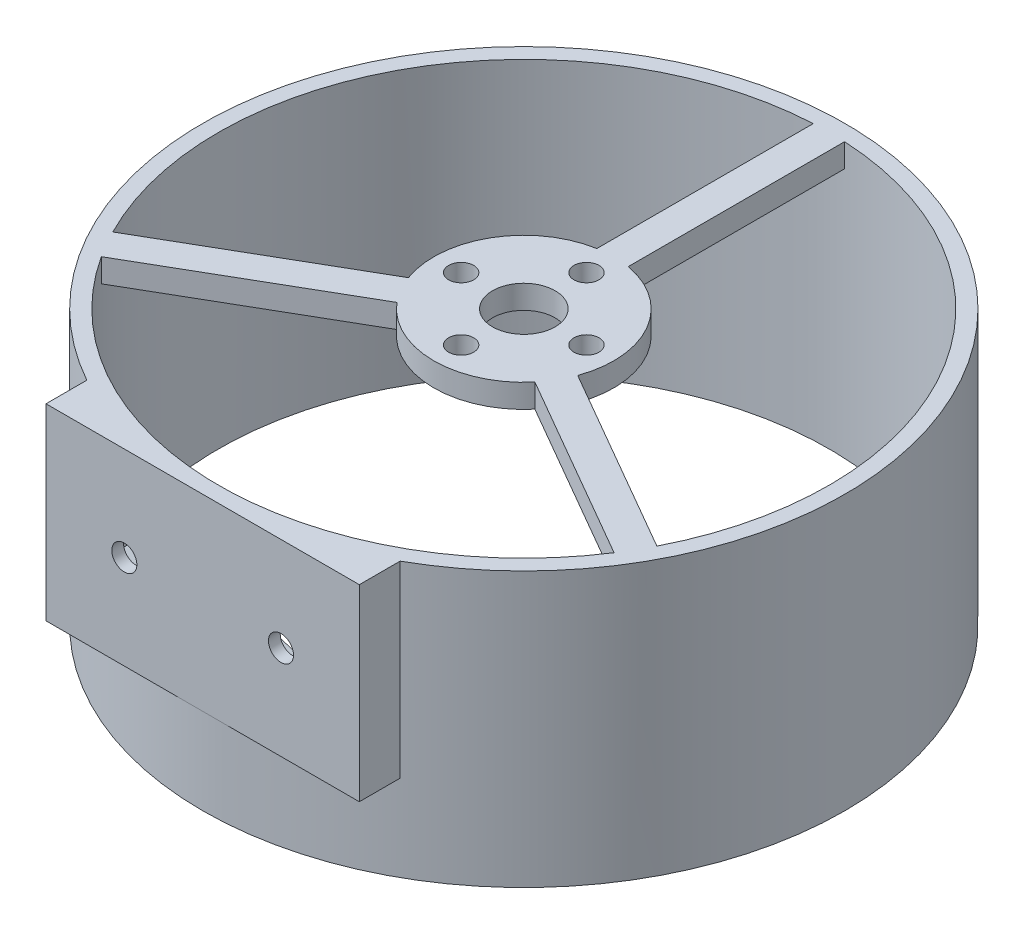
from build123d import *

# Parameters (mm, degrees)
SKETCH_1_R           = 41
SKETCH_1_R_2         = 39
EXTRUDE_1_DEPTH      = 20
EXTRUDE_START        = -14
EXTRUDE_2_DEPTH      = 14
EXTRUDE_START_2      = -3
SKETCH_3_R           = 4
SKETCH_3_R_2         = 1.6
EXTRUDE_3_DEPTH      = 3
CUT_EXTRUDE_3_DEPTH  = 3
EXTRUDE_5_DEPTH      = 10
EXTRUDE_5_DEPTH_BACK = 15
SKETCH_1_2_R         = 41
SKETCH_1_2_R_2       = 39
EXTRUDE_START_3      = 10
EXTRUDE_7_DEPTH      = 10
EXTRUDE_8_DEPTH      = 10
EXTRUDE_8_DEPTH_BACK = 5
CUT_EXTRUDE_4_DEPTH  = 10
EXTRUDE_9_DEPTH      = 10
EXTRUDE_9_DEPTH_BACK = 1.5
CUT_EXTRUDE_6_DEPTH  = 10
SKETCH_16_R          = 1.6
CUT_EXTRUDE_7_DEPTH  = 3
SKETCH_18_R          = 1.6
CUT_EXTRUDE_8_DEPTH  = 10
SKETCH_18_4_R        = 1.6
CUT_EXTRUDE_9_DEPTH  = 10


with BuildPart() as part:
    # 草图1 → 凸台-拉伸1 (new body)
    with BuildSketch(Plane(origin=(0, 0, 0), x_dir=(1, 0, 0), z_dir=(0, 1, 0))):
        Circle(SKETCH_1_R)
        Circle(SKETCH_1_R_2, mode=Mode.SUBTRACT)
    extrude(amount=EXTRUDE_1_DEPTH)

    # 草图2 → 凸台-拉伸2 (add)
    with BuildSketch(Plane(origin=(0, 20, 0), x_dir=(1, 0, 0), z_dir=(0, 1, 0)).offset(EXTRUDE_START)):
        with BuildLine():
            Line((3.5e-08, -41), (20, -41))
            Line((20, -41), (20, -35.791060336))
            ThreePointArc((20, -35.791060336), (10.333598766, -39.676400247), (3.5e-08, -41))
        make_face()
        with BuildLine():
            Line((-20, -41), (3.5e-08, -41))
            ThreePointArc((3.5e-08, -41), (-10.333598732, -39.676400256), (-20, -35.791060336))
            Line((-20, -35.791060336), (-20, -41))
        make_face()
    extrude(amount=EXTRUDE_2_DEPTH)

    # 草图3 → 凸台-拉伸3 (add)
    with BuildSketch(Plane(origin=(0, 20, 0), x_dir=(1, 0, 0), z_dir=(0, 1, 0)).offset(EXTRUDE_START_2)):
        with BuildLine():
            Line((-2, 38.948684188), (-2, 11.324751653))
            ThreePointArc((-2, 11.324751653), (-9.959292144, 5.75), (-10.807522623, -3.930325019))
            Line((-10.807522623, -3.930325019), (-34.730549951, -17.742291287))
            ThreePointArc((-34.730549951, -17.742291287), (-33.774990748, -19.5), (-32.730549951, -21.206392902))
            Line((-32.730549951, -21.206392902), (-8.807522623, -7.394426634))
            ThreePointArc((-8.807522623, -7.394426634), (0, -11.5), (8.807522623, -7.394426634))
            Line((8.807522623, -7.394426634), (32.730549951, -21.206392902))
            ThreePointArc((32.730549951, -21.206392902), (33.774990748, -19.5), (34.730549951, -17.742291287))
            Line((34.730549951, -17.742291287), (10.807522623, -3.930325019))
            ThreePointArc((10.807522623, -3.930325019), (9.959292144, 5.75), (2, 11.324751653))
            Line((2, 11.324751653), (2, 38.948684188))
            ThreePointArc((2, 38.948684188), (0, 39), (-2, 38.948684188))
        make_face()
        Circle(SKETCH_3_R, mode=Mode.SUBTRACT)
        with Locations((-8, 0)):
            Circle(SKETCH_3_R_2, mode=Mode.SUBTRACT)
        with Locations((8, 0)):
            Circle(SKETCH_3_R_2, mode=Mode.SUBTRACT)
    extrude(amount=EXTRUDE_3_DEPTH)

    # 草图7 → 切除-拉伸3 (cut)
    with BuildSketch(Plane.XZ.offset(-6)):
        with BuildLine():
            Line((0, 41), (-20, 41))
            Line((-20, 41), (-20, 35.791060336))
            ThreePointArc((-20, 35.791060336), (-10.333598749, 39.676400251), (0, 41))
        make_face()
        with BuildLine():
            Line((20, 41), (0, 41))
            ThreePointArc((0, 41), (10.333598749, 39.676400251), (20, 35.791060336))
            Line((20, 35.791060336), (20, 41))
        make_face()
    extrude(amount=-CUT_EXTRUDE_3_DEPTH, mode=Mode.SUBTRACT)

    # 草图1<2> → 凸台-拉伸5 (add, two sides: drawn at the far end of the back side and taken through both)
    with BuildSketch(Plane(origin=(0, 0, 0), x_dir=(1, 0, 0), z_dir=(0, 1, 0)).offset(-EXTRUDE_5_DEPTH_BACK)):
        Circle(SKETCH_1_2_R)
        Circle(SKETCH_1_2_R_2, mode=Mode.SUBTRACT)
    extrude(amount=EXTRUDE_5_DEPTH + EXTRUDE_5_DEPTH_BACK)

    # 草图7<4> → 凸台-拉伸7 (add)
    with BuildSketch(Plane.XZ.offset(-6).offset(EXTRUDE_START_3)):
        with BuildLine():
            Line((0, 41), (-20, 41))
            Line((-20, 41), (-20, 35.791060336))
            ThreePointArc((-20, 35.791060336), (-10.333598749, 39.676400251), (0, 41))
        make_face()
        with BuildLine():
            Line((20, 41), (0, 41))
            ThreePointArc((0, 41), (10.333598749, 39.676400251), (20, 35.791060336))
            Line((20, 35.791060336), (20, 41))
        make_face()
    extrude(amount=-EXTRUDE_7_DEPTH)

    # 草图7<5> → 凸台-拉伸8 (add, two sides: drawn at the far end of the back side and taken through both)
    with BuildSketch(Plane.XZ.offset(-6).offset(-EXTRUDE_8_DEPTH_BACK)):
        with BuildLine():
            Line((0, 41), (-20, 41))
            Line((-20, 41), (-20, 35.791060336))
            ThreePointArc((-20, 35.791060336), (-10.333598749, 39.676400251), (0, 41))
        make_face()
        with BuildLine():
            Line((20, 41), (0, 41))
            ThreePointArc((0, 41), (10.333598749, 39.676400251), (20, 35.791060336))
            Line((20, 35.791060336), (20, 41))
        make_face()
    extrude(amount=EXTRUDE_8_DEPTH + EXTRUDE_8_DEPTH_BACK)

    # 草图4 → 切除-拉伸4 (cut)
    with BuildSketch(Plane.XY.offset(41)):
        Polygon((-10, 4.766838493), (-7.2, 6.383419246), (-7.2, 9.616580754), (-10, 11.233161507), (-12.8, 9.616580754), (-12.8, 6.383419246), align=None)
        Polygon((12.8, 6.383419246), (10, 4.766838493), (7.2, 6.383419246), (7.2, 9.616580754), (10, 11.233161507), (12.8, 9.616580754), align=None)
    extrude(amount=-CUT_EXTRUDE_4_DEPTH, mode=Mode.SUBTRACT)

    # 草图4<3> → 凸台-拉伸9 (add, two sides: drawn at the far end of the back side and taken through both)
    with BuildSketch(Plane.XY.offset(41).offset(-EXTRUDE_9_DEPTH_BACK)):
        Polygon((-10, 4.766838493), (-7.2, 6.383419246), (-7.2, 9.616580754), (-10, 11.233161507), (-12.8, 9.616580754), (-12.8, 6.383419246), align=None)
        Polygon((12.8, 6.383419246), (10, 4.766838493), (7.2, 6.383419246), (7.2, 9.616580754), (10, 11.233161507), (12.8, 9.616580754), align=None)
    extrude(amount=EXTRUDE_9_DEPTH + EXTRUDE_9_DEPTH_BACK)

    # 草图13 → 切除-拉伸6 (cut)
    with BuildSketch(Plane.XY.offset(51)):
        Polygon((10, 11.233161507), (7.2, 9.616580754), (7.2, 6.383419246), (10, 4.766838493), (12.8, 6.383419246), (12.8, 9.616580754), align=None)
        Polygon((-10, 11.233161507), (-12.8, 9.616580754), (-12.8, 6.383419246), (-10, 4.766838493), (-7.2, 6.383419246), (-7.2, 9.616580754), align=None)
    extrude(amount=-CUT_EXTRUDE_6_DEPTH, mode=Mode.SUBTRACT)

    # 草图16 → 切除-拉伸7 (cut)
    with BuildSketch(Plane.XY.offset(41)):
        with Locations((-10, 8)):
            Circle(SKETCH_16_R)
        with Locations((10, 8)):
            Circle(SKETCH_16_R)
    extrude(amount=-CUT_EXTRUDE_7_DEPTH, mode=Mode.SUBTRACT)

    # 草图18 → 切除-拉伸8 (cut)
    with BuildSketch(Plane(origin=(0, 20, 0), x_dir=(1, 0, 0), z_dir=(0, 1, 0))):
        with Locations((0, 8)):
            Circle(SKETCH_18_R)
    extrude(amount=-CUT_EXTRUDE_8_DEPTH, mode=Mode.SUBTRACT)

    # 草图18<4> → 切除-拉伸9 (cut)
    with BuildSketch(Plane(origin=(0, 20, 0), x_dir=(1, 0, 0), z_dir=(0, 1, 0))):
        with Locations((0, 8)):
            Circle(SKETCH_18_4_R)
        with Locations((0, -8)):
            Circle(SKETCH_18_4_R)
    extrude(amount=-CUT_EXTRUDE_9_DEPTH, mode=Mode.SUBTRACT)


solid = part.part
